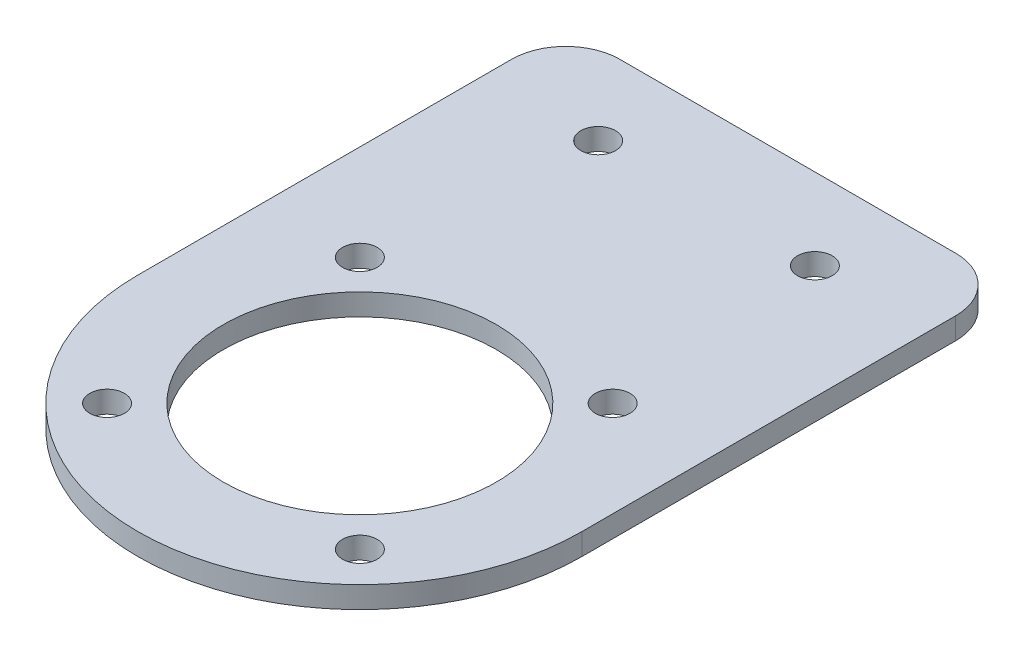
from build123d import *

# Parameters (mm, degrees)
SKETCH_1_R      = 1.6
SKETCH_1_R_2    = 20.5
SKETCH_1_R_3    = 12.6
EXTRUDE_1_DEPTH = 2
FILLET_1_R      = 5


with BuildPart() as part:
    # 草图1 → 凸台-拉伸1 (new body)
    # profile 1 of 2: a face of its own
    with BuildSketch(Plane(origin=(0, 0, 0), x_dir=(1, 0, 0), z_dir=(0, 1, 0))):
        with BuildLine():
            Line((-20.5, 39.5), (-20.5, 0))
            ThreePointArc((-20.5, 0), (0, 20.5), (20.5, 0))
            Line((20.5, 0), (20.5, 39.5))
            Line((20.5, 39.5), (-20.5, 39.5))
        make_face()
        with Locations(Location((-10, 32, 0), (0, 0, 270))):
            Circle(SKETCH_1_R, mode=Mode.SUBTRACT)
        with Locations(Location((10, 32, 0), (0, 0, 270))):
            Circle(SKETCH_1_R, mode=Mode.SUBTRACT)
    # profile 2 of 2: a face of its own
    with BuildSketch(Plane(origin=(0, 0, 0), x_dir=(1, 0, 0), z_dir=(0, 1, 0))):
        Circle(SKETCH_1_R_2)
        with Locations(Location((11.66726189, -11.66726189, 0), (0, 0, 270))):
            Circle(SKETCH_1_R, mode=Mode.SUBTRACT)
        with Locations(Location((11.66726189, 11.66726189, 0), (0, 0, 270))):
            Circle(SKETCH_1_R, mode=Mode.SUBTRACT)
        with Locations(Location((-11.66726189, 11.66726189, 0), (0, 0, 270))):
            Circle(SKETCH_1_R, mode=Mode.SUBTRACT)
        with Locations(Location((-11.66726189, -11.66726189, 0), (0, 0, 270))):
            Circle(SKETCH_1_R, mode=Mode.SUBTRACT)
        with Locations(Location((0, 0, 0), (0, 0, 270))):
            Circle(SKETCH_1_R_3, mode=Mode.SUBTRACT)
    extrude(amount=EXTRUDE_1_DEPTH)

    # 圆角1
    fillet_1_edges = [part.edges().sort_by_distance(p)[0] for p in [
        (-20.5, 1, -39.5),
        (20.5, 1, -39.5),
    ]]
    fillet(fillet_1_edges, radius=FILLET_1_R)


solid = part.part
